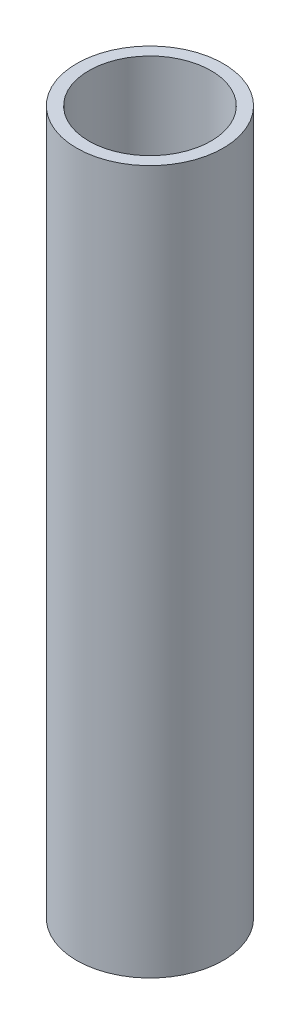
from build123d import *

# Parameters (mm, degrees)
SKETCH1_R           = 38.1
BOSS_EXTRUDE1_DEPTH = 365.76
SKETCH2_R           = 31.75
CUT_EXTRUDE1_DEPTH  = 370.707448667


with BuildPart() as part:
    # Sketch1 → Boss-Extrude1 (new body)
    with BuildSketch(Plane(origin=(0, 0, 0), x_dir=(1, 0, 0), z_dir=(0, 1, 0))):
        with Locations(Location((0, 0, 0), (0, 0, 270))):
            Circle(SKETCH1_R)
    extrude(amount=BOSS_EXTRUDE1_DEPTH)

    # Sketch2 → Cut-Extrude1 (cut, through all)
    with BuildSketch(Plane(origin=(0, 365.76, 0), x_dir=(1, 0, 0), z_dir=(0, 1, 0))):
        with Locations(Location((0, 0, 0), (0, 0, 270))):
            Circle(SKETCH2_R)
    extrude(amount=-CUT_EXTRUDE1_DEPTH, mode=Mode.SUBTRACT)


solid = part.part
